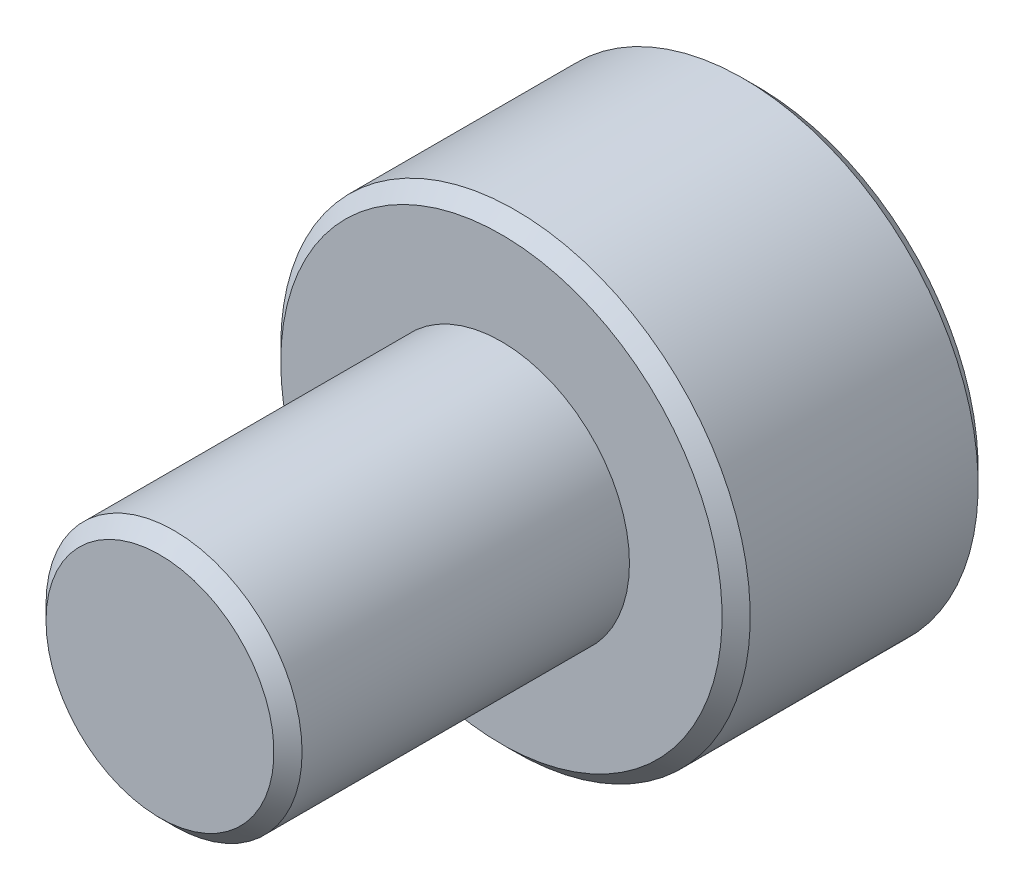
from build123d import *

# Parameters (mm, degrees)
SKETCH1_R          = 1.5
EXTRUDE1_DEPTH     = 4
SKETCH6_R          = 2.75
EXTRUDE2_DEPTH     = 3
CUT_EXTRUDE1_DEPTH = 1.875
CHAMFER1_SIZE      = 0.165


with BuildPart() as part:
    # Sketch1 → Extrude1 (new body)
    with BuildSketch(Plane.XY):
        Circle(SKETCH1_R)
    extrude(amount=-EXTRUDE1_DEPTH)

    # Sketch6 → Extrude2 (add)
    with BuildSketch(Plane(origin=(0, 0, -4), x_dir=(-1, 0, 0), z_dir=(0, 0, -1))):
        Circle(SKETCH6_R)
    extrude(amount=EXTRUDE2_DEPTH)

    # Sketch7 → Cut-Extrude1 (cut)
    with BuildSketch(Plane(origin=(0, 0, -7), x_dir=(-1, 0, 0), z_dir=(0, 0, -1))):
        Polygon((0, 1.443375673), (-1.25, 0.721687836), (-1.25, -0.721687836), (0, -1.443375673), (1.25, -0.721687836), (1.25, 0.721687836), align=None)
    extrude(amount=-CUT_EXTRUDE1_DEPTH, mode=Mode.SUBTRACT)

    # Cut-Extrude2 cone 1 section (through the dimple's axis) → Cut-Extrude2 (revolve, cut)
    with BuildSketch(Plane(origin=(0, 0, -7), x_dir=(0, 1, 0), z_dir=(1, 0, 0))):
        Polygon((0, 0), (1.443375673, 0), (0, 1.443375673), align=None)
    revolve(axis=Axis((0, 0, -7), (0, 0, 1)), mode=Mode.SUBTRACT)

    # Chamfer1
    chamfer1_edges = [part.edges().sort_by_distance(p)[0] for p in [
        (-1.5, 0, 0),
        (2.75, 0, -4),
        (2.75, 0, -7),
    ]]
    chamfer(chamfer1_edges, length=CHAMFER1_SIZE)


solid = part.part
